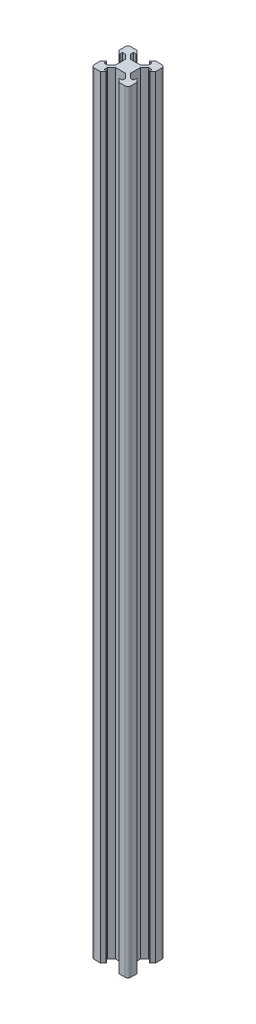
from build123d import *

# Parameters (mm, degrees)
EXTRUDE_1_DEPTH = 420


with BuildPart() as part:
    # Эскиз1 → Бобышка-Вытянуть1 (new body)
    with BuildSketch(Plane(origin=(0, 0, 0), x_dir=(1, 0, 0), z_dir=(0, 1, 0))):
        with BuildLine():
            Line((6.272792206, 5), (8, 5))
            Line((8, 5), (8, 3.724264069))
            ThreePointArc((8, 3.724264069), (8.18519497, 3.447100209), (8.512132034, 3.512132034))
            Line((8.512132034, 3.512132034), (10, 5))
            Line((10, 5), (10, 8.5))
            ThreePointArc((10, 8.5), (9.560660172, 9.560660172), (8.5, 10))
            Line((8.5, 10), (5, 10))
            Line((5, 10), (3.512132034, 8.512132034))
            ThreePointArc((3.512132034, 8.512132034), (3.447100209, 8.18519497), (3.724264069, 8))
            Line((3.724264069, 8), (5, 8))
            Line((5, 8), (5, 6.272792206))
            Line((5, 6.272792206), (2.727207794, 4))
            Line((2.727207794, 4), (-2.727207794, 4))
            Line((-2.727207794, 4), (-5, 6.272792206))
            Line((-5, 6.272792206), (-5, 8))
            Line((-5, 8), (-3.724264069, 8))
            ThreePointArc((-3.724264069, 8), (-3.447100209, 8.18519497), (-3.512132034, 8.512132034))
            Line((-3.512132034, 8.512132034), (-5, 10))
            Line((-5, 10), (-8.5, 10))
            ThreePointArc((-8.5, 10), (-9.560660172, 9.560660172), (-10, 8.5))
            Line((-10, 8.5), (-10, 5))
            Line((-10, 5), (-8.512132034, 3.512132034))
            ThreePointArc((-8.512132034, 3.512132034), (-8.18519497, 3.447100209), (-8, 3.724264069))
            Line((-8, 3.724264069), (-8, 5))
            Line((-8, 5), (-6.272792206, 5))
            Line((-6.272792206, 5), (-4, 2.727207794))
            Line((-4, 2.727207794), (-4, -2.727207794))
            Line((-4, -2.727207794), (-6.272792206, -5))
            Line((-6.272792206, -5), (-8, -5))
            Line((-8, -5), (-8, -3.724264069))
            ThreePointArc((-8, -3.724264069), (-8.18519497, -3.447100209), (-8.512132034, -3.512132034))
            Line((-8.512132034, -3.512132034), (-10, -5))
            Line((-10, -5), (-10, -8.5))
            ThreePointArc((-10, -8.5), (-9.560660172, -9.560660172), (-8.5, -10))
            Line((-8.5, -10), (-5, -10))
            Line((-5, -10), (-3.512132034, -8.512132034))
            ThreePointArc((-3.512132034, -8.512132034), (-3.447100209, -8.18519497), (-3.724264069, -8))
            Line((-3.724264069, -8), (-5, -8))
            Line((-5, -8), (-5, -6.272792206))
            Line((-5, -6.272792206), (-2.727207794, -4))
            Line((-2.727207794, -4), (2.727207794, -4))
            Line((2.727207794, -4), (5, -6.272792206))
            Line((5, -6.272792206), (5, -8))
            Line((5, -8), (3.724264069, -8))
            ThreePointArc((3.724264069, -8), (3.447100209, -8.18519497), (3.512132034, -8.512132034))
            Line((3.512132034, -8.512132034), (5, -10))
            Line((5, -10), (8.5, -10))
            ThreePointArc((8.5, -10), (9.560660172, -9.560660172), (10, -8.5))
            Line((10, -8.5), (10, -5))
            Line((10, -5), (8.512132034, -3.512132034))
            ThreePointArc((8.512132034, -3.512132034), (8.18519497, -3.447100209), (8, -3.724264069))
            Line((8, -3.724264069), (8, -5))
            Line((8, -5), (6.272792206, -5))
            Line((6.272792206, -5), (4, -2.727207794))
            Line((4, -2.727207794), (4, 2.727207794))
            Line((4, 2.727207794), (6.272792206, 5))
        make_face()
    extrude(amount=EXTRUDE_1_DEPTH)


solid = part.part
